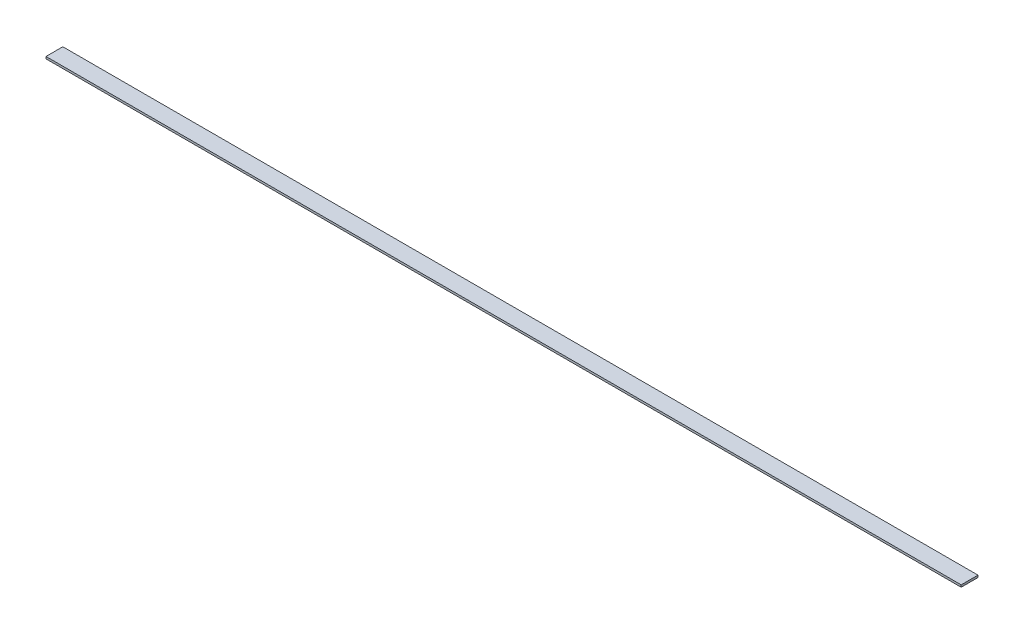
from build123d import *

# Parameters (mm, degrees)
SKETCH1_W           = 1088
SKETCH1_H           = 20
BOSS_EXTRUDE1_DEPTH = 2.5


with BuildPart() as part:
    # Sketch1 → Boss-Extrude1 (new body)
    with BuildSketch(Plane(origin=(0, 0, 0), x_dir=(1, 0, 0), z_dir=(0, 1, 0))):
        Rectangle(SKETCH1_W, SKETCH1_H)
    extrude(amount=BOSS_EXTRUDE1_DEPTH)


solid = part.part
